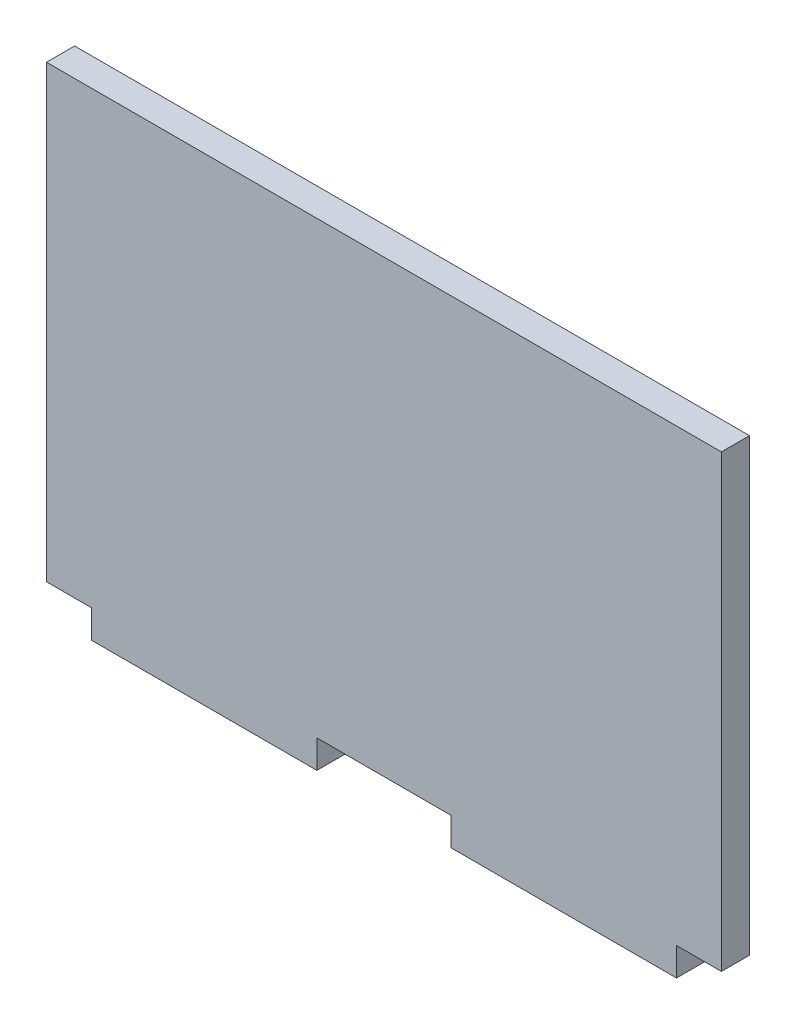
from build123d import *

# Parameters (mm, degrees)
SKETCH1_W           = 50.926738498
SKETCH1_H           = 6.35
SKETCH1_W_2         = 50.926738497
BOSS_EXTRUDE1_DEPTH = 6.35


with BuildPart() as part:
    # Sketch1 → Boss-Extrude1 (new body)
    with BuildSketch(Plane.XY):
        Polygon((-2.593337475, -25.401893638), (-2.593337475, 76.198106362), (-78.793337475, 76.198106362), (-78.793337475, -25.401893638), (-68.658315464, -25.401893638), (-17.731576967, -25.401893638), align=None)
        Polygon((73.606662525, 76.198106362), (-2.593337475, 76.198106362), (-2.593337475, -25.401893638), (12.544902016, -25.401893638), (63.471640514, -25.401893638), (73.606662525, -25.401893638), align=None)
        with Locations((38.008271265, -28.576893638)):
            Rectangle(SKETCH1_W, SKETCH1_H)
        with Locations((-43.194946215, -28.576893638)):
            Rectangle(SKETCH1_W_2, SKETCH1_H)
    extrude(amount=BOSS_EXTRUDE1_DEPTH)


solid = part.part
